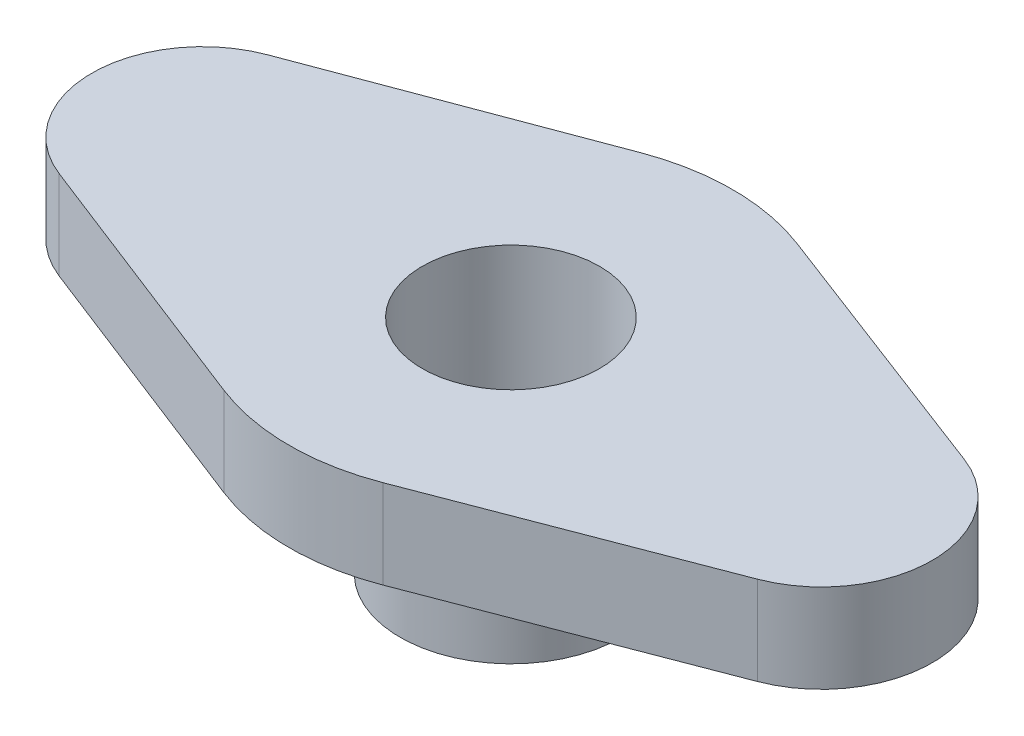
from build123d import *

# Parameters (mm, degrees)
EXTRUDE_419_DEPTH   = 20
SKETCH1_R           = 25
BOSS_EXTRUDE1_DEPTH = 30
SKETCH2_R           = 20
CUT_EXTRUDE1_DEPTH  = 119.427186528


with BuildPart() as part:
    # Эскиз1 → Extrude 419 (new body)
    with BuildSketch(Plane(origin=(0, 0, 0), x_dir=(-1, 0, 0), z_dir=(0, -1, 0))):
        with BuildLine():
            Line((-78.917505692, 23.388614652), (-17.835027079, 46.710938859))
            ThreePointArc((-17.835027079, 46.710938859), (-0.148812417, 49.999778548), (17.556665634, 46.816273793))
            Line((17.556665634, 46.816273793), (78.776887546, 23.857954408))
            ThreePointArc((78.776887546, 23.857954408), (94.998038561, 0.610466623), (79.076996078, -22.84357002))
            Line((79.076996078, -22.84357002), (18.156882698, -46.586775062))
            ThreePointArc((18.156882698, -46.586775062), (0.148812417, -49.999778548), (-17.879254632, -46.694028031))
            Line((-17.879254632, -46.694028031), (-78.939619469, -23.313868793))
            ThreePointArc((-78.939619469, -23.313868793), (-94.99998935, 0.044982802), (-78.917505692, 23.388614652))
        make_face()
    extrude(amount=EXTRUDE_419_DEPTH)

    # Sketch1 → Boss-Extrude1 (add)
    with BuildSketch(Plane.XZ.offset(20)):
        with Locations(Location((0, 0, 0), (0, 0, 270))):
            Circle(SKETCH1_R)
    extrude(amount=BOSS_EXTRUDE1_DEPTH)

    # Sketch2 → Cut-Extrude1 (cut, through all)
    with BuildSketch(Plane.XZ.offset(50)):
        with Locations(Location((0, 0, 0), (0, 0, 270))):
            Circle(SKETCH2_R)
    extrude(amount=-CUT_EXTRUDE1_DEPTH, mode=Mode.SUBTRACT)


solid = part.part
